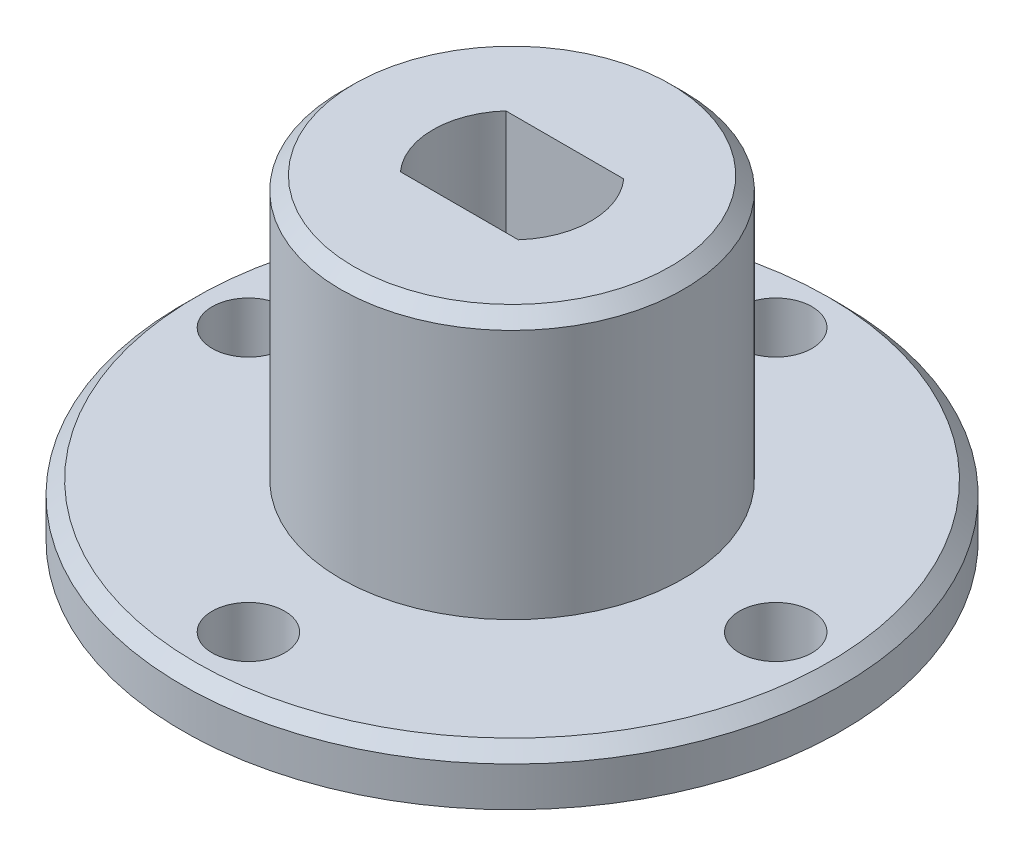
from build123d import *

# Parameters (mm, degrees)
SKIZZE1_R                       = 13
AUFSATZ_LINEAR_AUSTRAGEN1_DEPTH = 20
AUFSATZ_LINEAR_START            = 4
SKIZZE5_R                       = 25
AUFSATZ_LINEAR_AUSTRAGEN2_DEPTH = 4
DURCHGANGSLOCH_F_R_M51_D        = 5.5
DURCHGANGSLOCH_F_R_M51_DEPTH    = 25
DURCHGANGSLOCH_F_R_M51_TIP      = 1.652366702
FASE1_SIZE                      = 1


with BuildPart() as part:
    # Skizze1 → Aufsatz-Linear austragen1 (new body)
    with BuildSketch(Plane(origin=(0, 0, 0), x_dir=(1, 0, 0), z_dir=(0, 1, 0))):
        with Locations(Location((0, 0, 0), (0, 0, 270))):
            Circle(SKIZZE1_R)
        with BuildLine():
            Line((-4.472135955, 4), (4.472135955, 4))
            ThreePointArc((4.472135955, 4), (6, 0), (4.472135955, -4))
            Line((4.472135955, -4), (-4.472135955, -4))
            ThreePointArc((-4.472135955, -4), (-6, 0), (-4.472135955, 4))
        make_face(mode=Mode.SUBTRACT)
    extrude(amount=AUFSATZ_LINEAR_AUSTRAGEN1_DEPTH)

    # Skizze5 → Aufsatz-Linear austragen2 (add)
    with BuildSketch(Plane.XZ.offset(AUFSATZ_LINEAR_START)):
        with Locations(Location((0, 0, 0), (0, 0, 270))):
            Circle(SKIZZE5_R)
        with BuildLine():
            Line((4.472135955, -4), (-4.472135955, -4))
            ThreePointArc((-4.472135955, -4), (-6, 0), (-4.472135955, 4))
            Line((-4.472135955, 4), (4.472135955, 4))
            ThreePointArc((4.472135955, 4), (6, 0), (4.472135955, -4))
        make_face(mode=Mode.SUBTRACT)
    extrude(amount=-AUFSATZ_LINEAR_AUSTRAGEN2_DEPTH)

    # Durchgangsloch für M51
    with Locations(Plane(origin=(0, -4, 0), x_dir=(-1, 0, 0), z_dir=(0, -1, 0))):
        with Locations((0, 20), (20, 0), (0, -20), (-20, 0)):
            Hole(DURCHGANGSLOCH_F_R_M51_D / 2, depth=DURCHGANGSLOCH_F_R_M51_DEPTH)
            with Locations((0, 0, -(DURCHGANGSLOCH_F_R_M51_DEPTH + DURCHGANGSLOCH_F_R_M51_TIP / 2))):  # 118° drill point
                Cone(0, DURCHGANGSLOCH_F_R_M51_D / 2, DURCHGANGSLOCH_F_R_M51_TIP, mode=Mode.SUBTRACT)

    # Fase1
    fase1_edges = [part.edges().sort_by_distance(p)[0] for p in [
        (0, 0, 25),
        (0, 20, -13),
    ]]
    chamfer(fase1_edges, length=FASE1_SIZE)


solid = part.part
